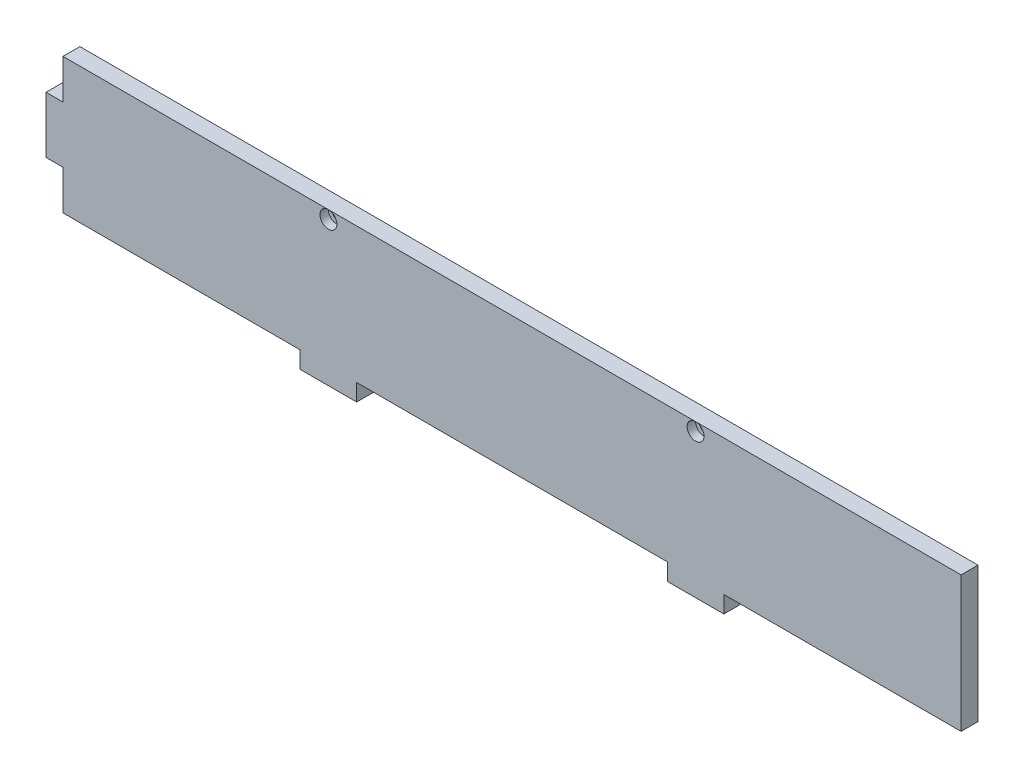
from build123d import *

# Parameters (mm, degrees)
ESQUISSE1_W             = 330
ESQUISSE1_H             = 54
BOSS_EXTRU_1_DEPTH      = 6
ESQUISSE2_W             = 6
ESQUISSE2_H             = 14
ESQUISSE2_W_2           = 110
ESQUISSE2_H_2           = 6
ENL_V_MAT_EXTRU_1_DEPTH = 335.442820225
ESQUISSE3_R             = 1.5
ESQUISSE3_W             = 6
ESQUISSE3_H             = 20
ENL_V_MAT_EXTRU_2_DEPTH = 6
ESQUISSE4_R             = 2.995
ENL_V_MAT_EXTRU_3_DEPTH = 3


with BuildPart() as part:
    # Esquisse1 → Boss.-Extru.1 (new body)
    with BuildSketch(Plane.XY):
        with Locations((-165, 27)):
            Rectangle(ESQUISSE1_W, ESQUISSE1_H)
    extrude(amount=BOSS_EXTRU_1_DEPTH)

    # Esquisse2 → Enlèv. mat.-Extru.1 (cut, through all)
    with BuildSketch(Plane.XY.offset(6)):
        Polygon((-330, 0), (-240, 0), (-240, 6), (-324, 6), (-324, 20), (-330, 20), align=None)
        Polygon((-90, 6), (-90, 0), (0, 0), (0, 20), (-6, 20), (-6, 6), align=None)
        with Locations((-327, 47)):
            Rectangle(ESQUISSE2_W, ESQUISSE2_H)
        with Locations((-3, 47)):
            Rectangle(ESQUISSE2_W, ESQUISSE2_H)
        with Locations((-165, 3)):
            Rectangle(ESQUISSE2_W_2, ESQUISSE2_H_2)
    extrude(amount=-ENL_V_MAT_EXTRU_1_DEPTH, mode=Mode.SUBTRACT)

    # Esquisse3 → Enlèv. mat.-Extru.2 (cut)
    with BuildSketch(Plane.XY.offset(6)):
        with Locations((-230, 51)):
            Circle(ESQUISSE3_R)
        with Locations((-100, 51)):
            Circle(ESQUISSE3_R)
        with Locations((-3, 30)):
            Rectangle(ESQUISSE3_W, ESQUISSE3_H)
    extrude(amount=-ENL_V_MAT_EXTRU_2_DEPTH, mode=Mode.SUBTRACT)

    # Esquisse4 → Enlèv. mat.-Extru.3 (cut)
    with BuildSketch(Plane.XY.offset(6)):
        with Locations((-230, 51)):
            Circle(ESQUISSE4_R)
        with Locations((-100, 51)):
            Circle(ESQUISSE4_R)
    extrude(amount=-ENL_V_MAT_EXTRU_3_DEPTH, mode=Mode.SUBTRACT)


solid = part.part
